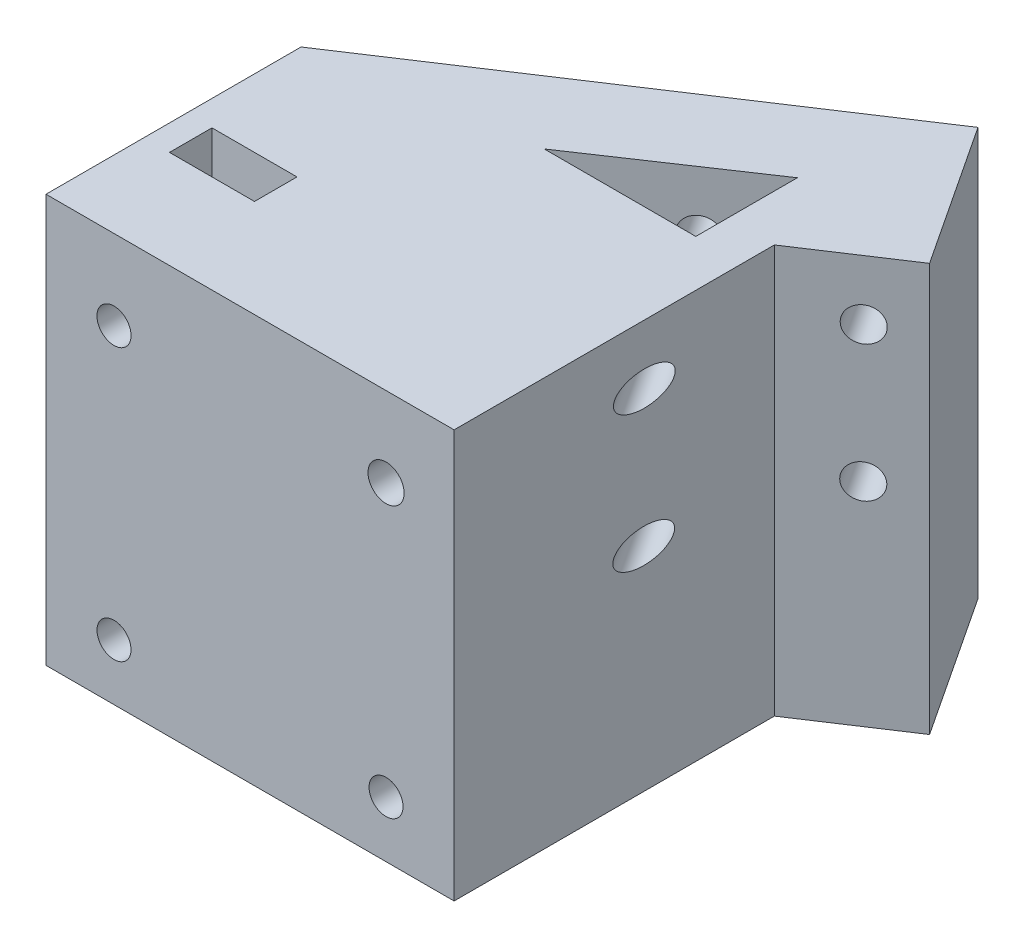
from build123d import *
from build123d.topology import SkipClean

# Parameters (mm, degrees)
BOSS_EXTRUDE1_DEPTH = 48
SKETCH4_R           = 2
CUT_EXTRUDE2_DEPTH  = 50
SKETCH2_W           = 48.006
SKETCH2_H           = 48
SKETCH2_R           = 2
SKETCH2_R_2         = 2.006782391
SKETCH2_R_3         = 2.123456522
BOSS_EXTRUDE2_DEPTH = 30
SKETCH5_R           = 4
CUT_EXTRUDE3_DEPTH  = 6
CUT_EXTRUDE4_DEPTH  = 70
SKETCH7_R           = 2
CUT_EXTRUDE5_DEPTH  = 70
CUT_EXTRUDE6_START  = -40
SKETCH8_R           = 2
SKETCH8_R_2         = 2.123456522
CUT_EXTRUDE6_DEPTH  = 40
SKETCH9_W           = 9.595017639
SKETCH9_H           = 48
SKETCH9_R           = 2
BOSS_EXTRUDE3_DEPTH = 20
SKETCH10_W          = 4
SKETCH10_H          = 48
BOSS_EXTRUDE4_DEPTH = 6
SKETCH11_W          = 10
SKETCH11_H          = 5
CUT_EXTRUDE7_DEPTH  = 100


with BuildPart() as part:
    # Sketch1 → Boss-Extrude1 (new body)
    with BuildSketch(Plane(origin=(0, 0, 0), x_dir=(1, 0, 0), z_dir=(0, 1, 0))):
        Polygon((0, 0), (48.006, 0), (48.006, 31.625281142), align=None)
    extrude(amount=BOSS_EXTRUDE1_DEPTH)

    # Sketch4 → Cut-Extrude2 (cut)
    with BuildSketch(Plane(origin=(0, 0, 0), x_dir=(-0.8350783748488168, 0, 0.5501309915464309), z_dir=(-0.5501309915464309, 0, -0.8350783748488168))):
        with Locations((-51.897260347, 40.980827232)):
            Circle(SKETCH4_R)
        with Locations((-35.895484188, 41.020948927)):
            Circle(SKETCH4_R)
        with Locations((-35.855362493, 25.019172768)):
            Circle(SKETCH4_R)
        with Locations((-51.857138652, 24.979051073)):
            Circle(SKETCH4_R)
    extrude(amount=-CUT_EXTRUDE2_DEPTH, mode=Mode.SUBTRACT)

    # Sketch2 → Boss-Extrude2 (add)
    with BuildSketch(Plane.XY):
        with Locations((24.003, 24)):
            Rectangle(SKETCH2_W, SKETCH2_H)
        with Locations((8, 6.6)):
            Circle(SKETCH2_R, mode=Mode.SUBTRACT)
        with Locations((8, 38.6)):
            Circle(SKETCH2_R_2, mode=Mode.SUBTRACT)
        with Locations((40, 6.6)):
            Circle(SKETCH2_R, mode=Mode.SUBTRACT)
        with Locations(Location((40, 38.6, 0), (0, 0, 72.548693829))):
            Circle(SKETCH2_R_3, mode=Mode.SUBTRACT)
    extrude(amount=BOSS_EXTRUDE2_DEPTH)

    # Sketch5 → Cut-Extrude3 (cut)
    with BuildSketch(Plane(origin=(0, 0, 0), x_dir=(-0.8350783748488168, 0, 0.5501309915464309), z_dir=(-0.5501309915464309, 0, -0.8350783748488168))):
        with Locations((-43.857138652, 32.979051073)):
            Circle(SKETCH5_R)
    extrude(amount=-CUT_EXTRUDE3_DEPTH, mode=Mode.SUBTRACT)

    # Sketch6 → Cut-Extrude4 (cut)
    with BuildSketch(Plane.XZ):
        Polygon((24.689890757, -3.915790227), (42.514740204, -3.915790227), (42.514740204, -15.872358278), align=None)
    extrude(amount=-CUT_EXTRUDE4_DEPTH, mode=Mode.SUBTRACT)

    # Sketch7 → Cut-Extrude5 (cut)
    with BuildSketch(Plane(origin=(0, 0, 0), x_dir=(-0.8350783748488168, 0, 0.5501309915464309), z_dir=(-0.5501309915464309, 0, -0.8350783748488168))):
        with Locations((-35.855362493, 25.019172768)):
            Circle(SKETCH7_R)
        with Locations((-35.895484188, 41.020948927)):
            Circle(SKETCH7_R)
    extrude(amount=-CUT_EXTRUDE5_DEPTH, mode=Mode.SUBTRACT)

    # Sketch8 → Cut-Extrude6 (cut)
    with BuildSketch(Plane.XY.offset(30).offset(CUT_EXTRUDE6_START)):
        with Locations((40, 6.6)):
            Circle(SKETCH8_R)
        with Locations(Location((40, 38.6, 0), (0, 0, 140.05141704))):
            Circle(SKETCH8_R_2)
    extrude(amount=CUT_EXTRUDE6_DEPTH, mode=Mode.SUBTRACT)

    # Sketch9 → Boss-Extrude3 (add)
    with SkipClean():  # the faces are left unmerged after this step: merging them gives an invalid solid
        with BuildSketch(Plane(origin=(0, 0, 0), x_dir=(-0.8350783748488168, 0, 0.5501309915464309), z_dir=(-0.5501309915464309, 0, -0.8350783748488169))):
            with Locations((-52.689310917, 24)):
                Rectangle(SKETCH9_W, SKETCH9_H)
            with Locations((-51.857138652, 24.979051073)):
                Circle(SKETCH9_R, mode=Mode.SUBTRACT)
            with Locations((-51.897260347, 40.980827232)):
                Circle(SKETCH9_R, mode=Mode.SUBTRACT)
        extrude(amount=-BOSS_EXTRUDE3_DEPTH)

    # Sketch10 → Boss-Extrude4 (add)
    with SkipClean():  # the faces are left unmerged after this step: merging them gives an invalid solid
        with BuildSketch(Plane(origin=(11.002619831, 0, 16.701567497), x_dir=(0.8350783748488168, 0, -0.5501309915464307), z_dir=(0.5501309915464307, 0, 0.8350783748488168))):
            with Locations((45.891802097, 24)):
                Rectangle(SKETCH10_W, SKETCH10_H)
        extrude(amount=-BOSS_EXTRUDE4_DEPTH)

    # Sketch11 → Cut-Extrude7 (cut)
    with SkipClean():  # the faces are left unmerged after this step: merging them gives an invalid solid
        with BuildSketch(Plane(origin=(0, 48, 0), x_dir=(1, 0, 0), z_dir=(0, 1, 0))):
            with Locations((8, -15.976429849)):
                Rectangle(SKETCH11_W, SKETCH11_H)
        extrude(amount=-CUT_EXTRUDE7_DEPTH, mode=Mode.SUBTRACT)


solid = part.part
